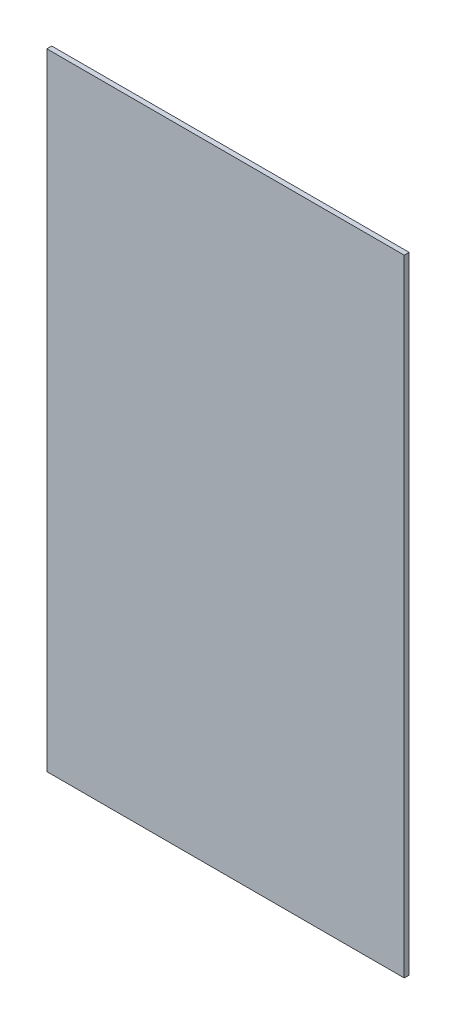
from build123d import *

# Parameters (mm, degrees)
ESQUISSE1_W        = 475
ESQUISSE1_H        = 832
BOSS_EXTRU_1_DEPTH = 6.5


with BuildPart() as part:
    # Esquisse1 → Boss.-Extru.1 (new body)
    with BuildSketch(Plane.XY):
        Rectangle(ESQUISSE1_W, ESQUISSE1_H)
    extrude(amount=BOSS_EXTRU_1_DEPTH)


solid = part.part
